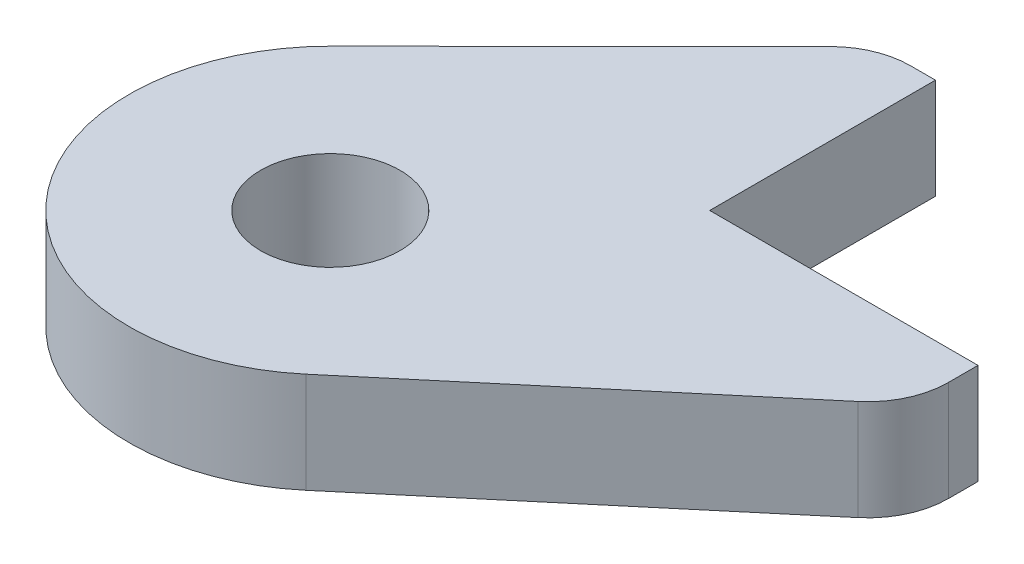
from build123d import *

# Parameters (mm, degrees)
BOSS_EXTRUDE2_DEPTH  = 4.7625
FILLET3_R            = 3.81
M6_CLEARANCE_HOLE3_D = 6.6


with BuildPart() as part:
    # Sketch4 → Boss-Extrude2 (new body)
    with BuildSketch(Plane(origin=(0, 0, 0), x_dir=(1, 0, 0), z_dir=(0, 1, 0))):
        with BuildLine():
            Line((-12.7, -2.013948776), (-12.7, -12.7))
            Line((-12.7, -12.7), (0, -12.7))
            Line((0, -12.7), (0, -15.875))
            Line((0, -15.875), (-15.544691969, -28.965891134))
            ThreePointArc((-15.544691969, -28.965891134), (-28.701038648, -28.117199317), (-28.407157173, -14.936783186))
            Line((-28.407157173, -14.936783186), (-15.452487049, -2.013948776))
            Line((-15.452487049, -2.013948776), (-12.7, -2.013948776))
        make_face()
    extrude(amount=BOSS_EXTRUDE2_DEPTH)

    # Fillet3
    fillet3_edges = [part.edges().sort_by_distance(p)[0] for p in [
        (0, 2.38125, 15.875),
        (-15.452487049, 2.38125, 2.013948776),
    ]]
    fillet(fillet3_edges, radius=FILLET3_R)

    # M6 Clearance Hole3 (through all)
    with Locations(Plane(origin=(0, 4.7625, 0), x_dir=(1, 0, 0), z_dir=(0, 1, 0))):
        with Locations((-21.680256121, -21.680256121)):
            Hole(M6_CLEARANCE_HOLE3_D / 2)


solid = part.part
